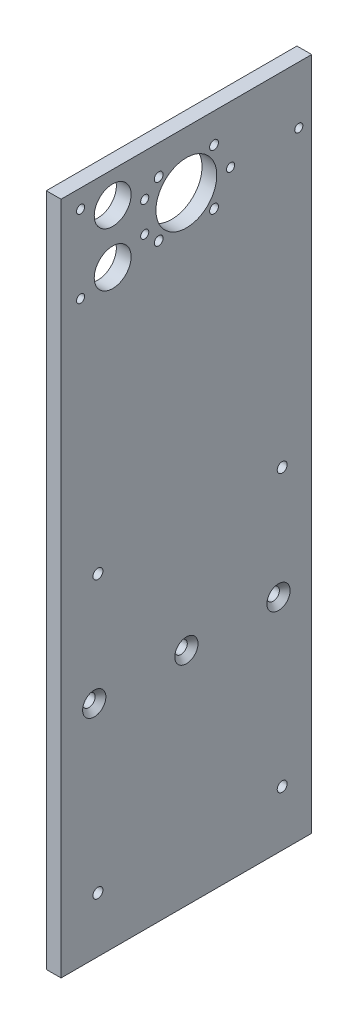
from build123d import *

# Parameters (mm, degrees)
SKETCH_1_W                   = 68
SKETCH_1_H                   = 180
EXTRUDE_1_DEPTH              = 4
HOLE_WIZARD_M2_1_D           = 2.4
HOLE_WIZARD_M2_1_DEPTH       = 7.5
HOLE_WIZARD_M2_1_CSINK_D     = 4.4
HOLE_WIZARD_M2_1_CSINK_ANGLE = 90
HOLE_WIZARD_M2_1_TIP         = 0.721032743
SKETCH_4_R                   = 8.25
CUT_EXTRUDE_1_DEPTH          = 97.291224938
HOLE_WIZARD_M3_1_D           = 3.4
HOLE_WIZARD_M3_1_DEPTH       = 7.5
HOLE_WIZARD_M3_1_CSINK_D     = 6.3
HOLE_WIZARD_M3_1_CSINK_ANGLE = 90
HOLE_WIZARD_M3_1_TIP         = 1.021463052
F_1_0MM_1_D                  = 2.2
SKETCH_17_W                  = 4
SKETCH_17_H                  = 68
EXTRUDE_2_DEPTH              = 3
F_1_0MM_2_D                  = 2.2
F_1_0MM_2_DEPTH              = 6.35
F_1_0MM_2_TIP                = 0.660946681
SKETCH_21_R                  = 5
CUT_EXTRUDE_4_DEPTH          = 100.100958623
F_1_0MM_3_D                  = 2.2
F_1_0MM_3_DEPTH              = 7.25
F_1_0MM_3_TIP                = 0.660946681
F_1_0MM_4_D                  = 2.7


with BuildPart() as part:
    # 草圖1 → 填料-伸長1 (new body)
    with BuildSketch(Plane(origin=(0, 0, 0), x_dir=(0, 0, -1), z_dir=(1, 0, 0))):
        Rectangle(SKETCH_1_W, SKETCH_1_H)
    extrude(amount=EXTRUDE_1_DEPTH)

    # M2 錐坑平頭螺釘的錐孔1
    with Locations(Plane.ZY):
        with Locations((-7.5, 85), (-7.5, 70), (7.5, 85), (7.5, 70)):
            CounterSinkHole(HOLE_WIZARD_M2_1_D / 2, HOLE_WIZARD_M2_1_CSINK_D / 2, depth=HOLE_WIZARD_M2_1_DEPTH, counter_sink_angle=HOLE_WIZARD_M2_1_CSINK_ANGLE)
            with Locations((0, 0, -(HOLE_WIZARD_M2_1_DEPTH + HOLE_WIZARD_M2_1_TIP / 2))):  # 118° drill point
                Cone(0, HOLE_WIZARD_M2_1_D / 2, HOLE_WIZARD_M2_1_TIP, mode=Mode.SUBTRACT)

    # 草圖4 → 除料-伸長1 (cut, through all)
    with BuildSketch(Plane.ZY):
        with Locations((0, 77.5)):
            Circle(SKETCH_4_R)
    extrude(amount=-CUT_EXTRUDE_1_DEPTH, mode=Mode.SUBTRACT)

    # M3 錐坑平頭螺釘的錐孔1
    with Locations(Plane(origin=(4, 0, 0), x_dir=(0, 0, -1), z_dir=(1, 0, 0))):
        with Locations((-25, -30), (0, -30), (25, -30)):
            CounterSinkHole(HOLE_WIZARD_M3_1_D / 2, HOLE_WIZARD_M3_1_CSINK_D / 2, depth=HOLE_WIZARD_M3_1_DEPTH, counter_sink_angle=HOLE_WIZARD_M3_1_CSINK_ANGLE)
            with Locations((0, 0, -(HOLE_WIZARD_M3_1_DEPTH + HOLE_WIZARD_M3_1_TIP / 2))):  # 118° drill point
                Cone(0, HOLE_WIZARD_M3_1_D / 2, HOLE_WIZARD_M3_1_TIP, mode=Mode.SUBTRACT)

    # Ø1.0mm 定位孔1 (through all)
    with Locations(Plane(origin=(4, 0, 0), x_dir=(0, 0, -1), z_dir=(1, 0, 0))):
        with Locations((12, 77.5), (30.5, 77.5)):
            Hole(F_1_0MM_1_D / 2)

    # 草圖17 → 填料-伸長2 (add)
    with BuildSketch(Plane(origin=(0, 90, 0), x_dir=(1, 0, 0), z_dir=(0, 1, 0))):
        with Locations((2, 0)):
            Rectangle(SKETCH_17_W, SKETCH_17_H)
    extrude(amount=EXTRUDE_2_DEPTH)

    # Ø1.0mm 定位孔2
    with Locations(Plane.ZY):
        with Locations((28.7, 88), (28.7, 67), (11.3, 81.6), (11.3, 73.4)):
            Hole(F_1_0MM_2_D / 2, depth=F_1_0MM_2_DEPTH)
            with Locations((0, 0, -(F_1_0MM_2_DEPTH + F_1_0MM_2_TIP / 2))):  # 118° drill point
                Cone(0, F_1_0MM_2_D / 2, F_1_0MM_2_TIP, mode=Mode.SUBTRACT)

    # 草圖21 → 除料-伸長4 (cut, through all)
    with BuildSketch(Plane.ZY):
        with Locations((20, 84.6)):
            Circle(SKETCH_21_R)
        with Locations((20, 70)):
            Circle(SKETCH_21_R)
    extrude(amount=-CUT_EXTRUDE_4_DEPTH, mode=Mode.SUBTRACT)

    # Ø1.0mm 定位孔3
    with Locations(Plane(origin=(0, -90, 0), x_dir=(-1, 0, 0), z_dir=(0, -1, 0))):
        with Locations((-2, 0), (-2, -25), (-2, 25)):
            Hole(F_1_0MM_3_D / 2, depth=F_1_0MM_3_DEPTH)
            with Locations((0, 0, -(F_1_0MM_3_DEPTH + F_1_0MM_3_TIP / 2))):  # 118° drill point
                Cone(0, F_1_0MM_3_D / 2, F_1_0MM_3_TIP, mode=Mode.SUBTRACT)

    # Ø1.0mm 定位孔4 (through all)
    with Locations(Plane(origin=(4, 0, 0), x_dir=(0, 0, -1), z_dir=(1, 0, 0))):
        with Locations((26, -75), (26, 0), (-24, 0), (-24, -75)):
            Hole(F_1_0MM_4_D / 2)


solid = part.part
